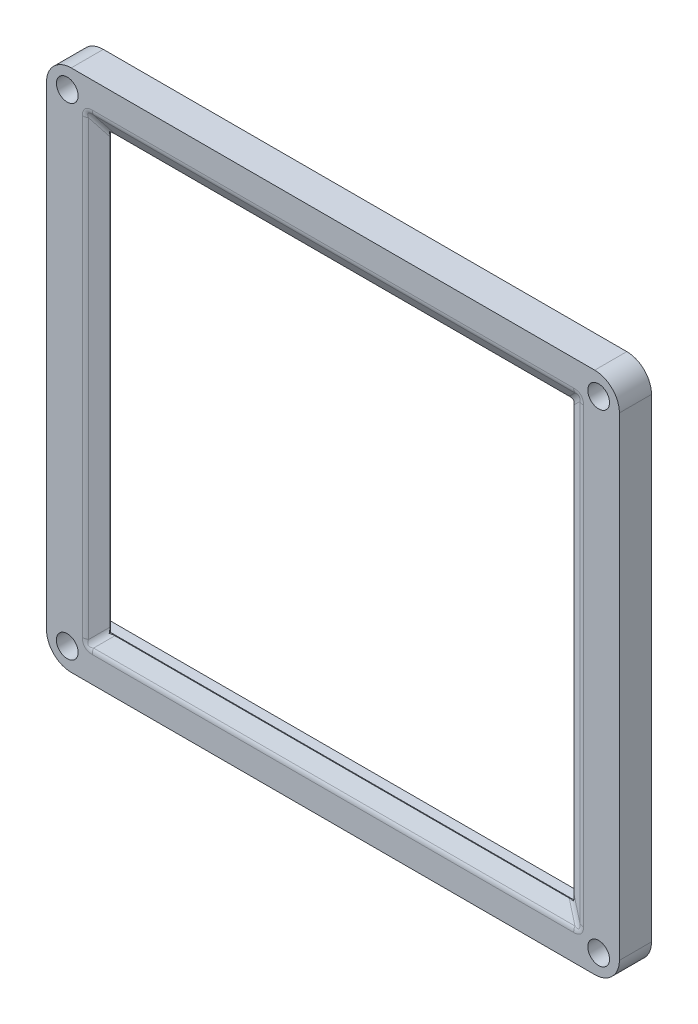
from build123d import *
from build123d.topology import SkipClean

# Parameters (mm, degrees)
SKETCH_1_R      = 1.1
SKETCH_1_W      = 47
SKETCH_1_H      = 44
EXTRUDE_1_DEPTH = 1
EXTRUDE_START   = 2.25
SKETCH_2_R      = 1.1
SKETCH_2_W      = 51.5
SKETCH_2_H      = 46.5
EXTRUDE_2_DEPTH = 2.25
CHAMFER_1_SIZE  = 1.6
CHAMFER_1_SIZE2 = 0.923760431
FILLET_1_R      = 1


with BuildPart() as part:
    # 草图1 → 凸台-拉伸1 (new body)
    with BuildSketch(Plane.XY):
        with BuildLine():
            Line((-26.5, -26.5), (26.5, -26.5))
            ThreePointArc((26.5, -26.5), (28.267766953, -25.767766953), (29, -24))
            Line((29, -24), (29, 24))
            ThreePointArc((29, 24), (28.267766953, 25.767766953), (26.5, 26.5))
            Line((26.5, 26.5), (-26.5, 26.5))
            ThreePointArc((-26.5, 26.5), (-28.267766953, 25.767766953), (-29, 24))
            Line((-29, 24), (-29, -24))
            ThreePointArc((-29, -24), (-28.267766953, -25.767766953), (-26.5, -26.5))
        make_face()
        with Locations((-26.9, 24.4)):
            Circle(SKETCH_1_R, mode=Mode.SUBTRACT)
        with Locations(Location((26.9, 24.4, 0), (0, 0, 180))):
            Circle(SKETCH_1_R, mode=Mode.SUBTRACT)
        with Locations(Location((-26.9, -24.4, 0), (0, 0, 180))):
            Circle(SKETCH_1_R, mode=Mode.SUBTRACT)
        with Locations((26.9, -24.4)):
            Circle(SKETCH_1_R, mode=Mode.SUBTRACT)
        Rectangle(SKETCH_1_W, SKETCH_1_H, mode=Mode.SUBTRACT)
    extrude(amount=EXTRUDE_1_DEPTH)

    # 草图2 → 凸台-拉伸2 (add)
    with SkipClean():  # the faces are left unmerged after this step: merging them gives an invalid solid
        with BuildSketch(Plane(origin=(0, 0, 0), x_dir=(-1, 0, 0), z_dir=(0, 0, -1)).offset(EXTRUDE_START)):
            with BuildLine():
                Line((26.5, 26.5), (-26.5, 26.5))
                ThreePointArc((-26.5, 26.5), (-28.267766953, 25.767766953), (-29, 24))
                Line((-29, 24), (-29, -24))
                ThreePointArc((-29, -24), (-28.267766953, -25.767766953), (-26.5, -26.5))
                Line((-26.5, -26.5), (26.5, -26.5))
                ThreePointArc((26.5, -26.5), (28.267766953, -25.767766953), (29, -24))
                Line((29, -24), (29, 24))
                ThreePointArc((29, 24), (28.267766953, 25.767766953), (26.5, 26.5))
            make_face()
            with Locations((26.9, -24.4)):
                Circle(SKETCH_2_R, mode=Mode.SUBTRACT)
            with Locations((-26.9, -24.4)):
                Circle(SKETCH_2_R, mode=Mode.SUBTRACT)
            with Locations((-26.9, 24.4)):
                Circle(SKETCH_2_R, mode=Mode.SUBTRACT)
            with Locations((26.9, 24.4)):
                Circle(SKETCH_2_R, mode=Mode.SUBTRACT)
            Rectangle(SKETCH_2_W, SKETCH_2_H, mode=Mode.SUBTRACT)
        extrude(amount=-EXTRUDE_2_DEPTH)

    # 倒角1
    chamfer_1_edges = [part.edges().sort_by_distance(p)[0] for p in [
        (-23.5, 0, 1),
        (0, -22, 1),
        (23.5, 0, 1),
        (0, 22, 1),
    ]]
    chamfer_1_side = [part.faces().sort_by_distance(p)[0] for p in [
        (0, -25.714315585, 1),
    ]]
    chamfer(chamfer_1_edges, length=CHAMFER_1_SIZE, length2=CHAMFER_1_SIZE2, reference=chamfer_1_side[0])

    # 圆角1
    fillet_1_edges = [part.edges().sort_by_distance(p)[0] for p in [
        (0, 23.6, 1),
        (25.1, 0, 1),
        (0, -23.6, 1),
        (-25.1, 0, 1),
        (24.3, 22.8, 0.538119785),
        (24.3, -22.8, 0.538119785),
        (-24.3, 22.8, 0.538119785),
        (-24.3, -22.8, 0.538119785),
    ]]
    fillet(fillet_1_edges, radius=FILLET_1_R)


solid = part.part
